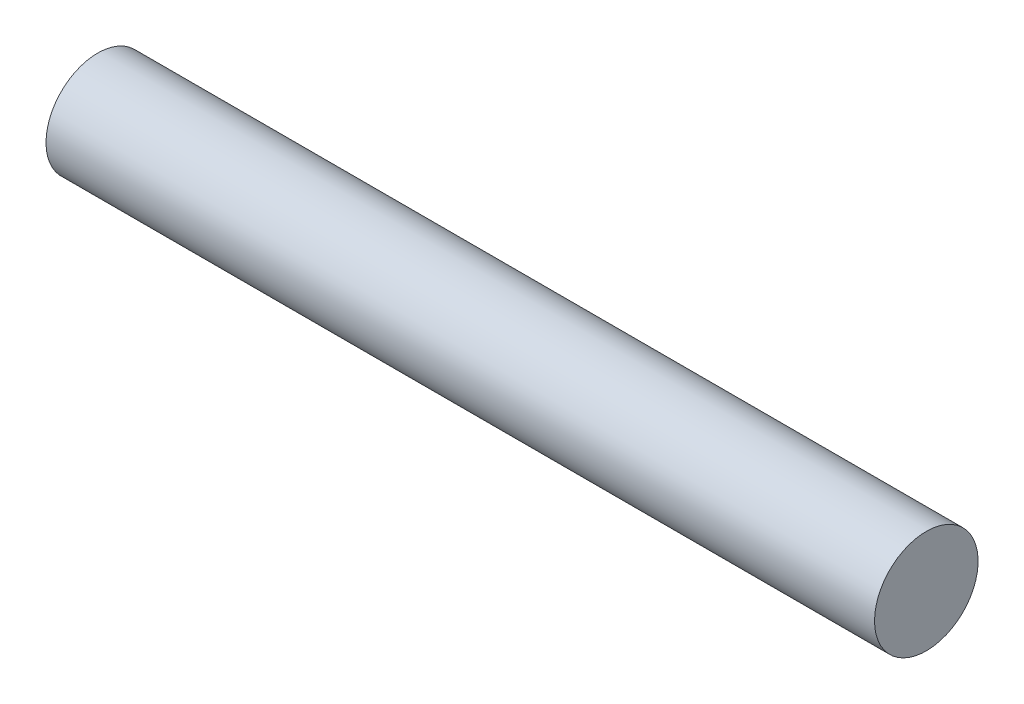
from build123d import *

# Parameters (mm, degrees)
SKETCH1_R           = 2.38125
BOSS_EXTRUDE1_DEPTH = 19.05


with BuildPart() as part:
    # Sketch1 → Boss-Extrude1 (new, symmetric)
    with BuildSketch(Plane(origin=(0, 0, 0), x_dir=(0, 0, -1), z_dir=(1, 0, 0))):
        with Locations(Location((0, 0, 0), (0, 0, 180))):
            Circle(SKETCH1_R)
    extrude(amount=BOSS_EXTRUDE1_DEPTH, both=True)


solid = part.part
